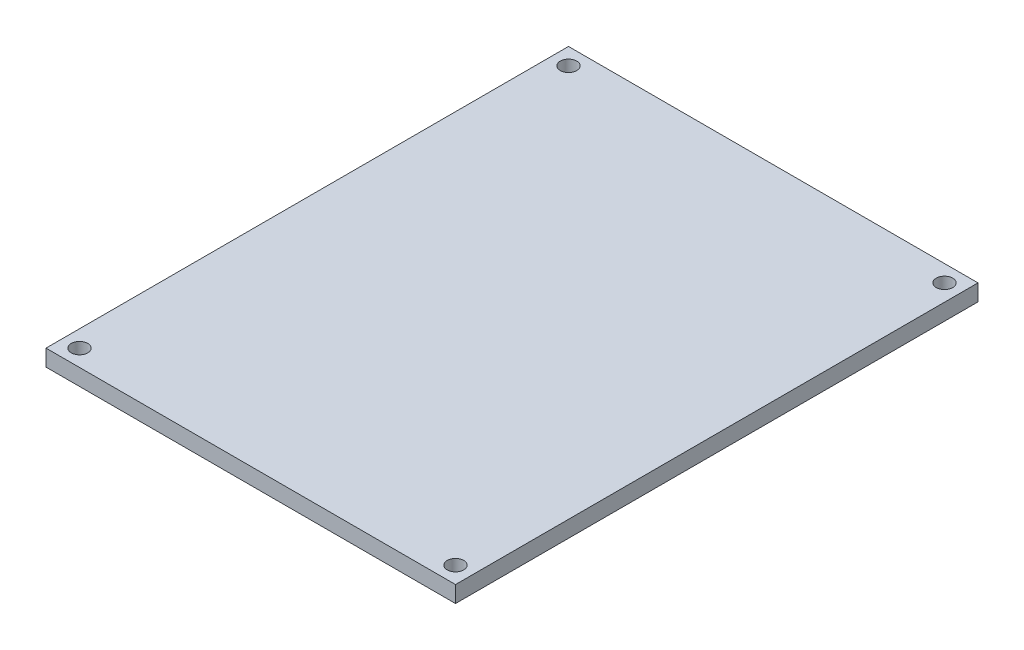
from build123d import *

# Parameters (mm, degrees)
SKETCH_1_W      = 74.56
SKETCH_1_H      = 95.13
SKETCH_1_R      = 1.5
EXTRUDE_1_DEPTH = 3


with BuildPart() as part:
    # 草图1 → 凸台-拉伸1 (new body)
    with BuildSketch(Plane(origin=(0, 0, 0), x_dir=(1, 0, 0), z_dir=(0, 1, 0))):
        Rectangle(SKETCH_1_W, SKETCH_1_H)
        with Locations(Location((-34.225, 44.515, 0), (0, 0, 270))):
            Circle(SKETCH_1_R, mode=Mode.SUBTRACT)
        with Locations(Location((34.225, 44.515, 0), (0, 0, 90))):
            Circle(SKETCH_1_R, mode=Mode.SUBTRACT)
        with Locations(Location((34.225, -44.515, 0), (0, 0, 270))):
            Circle(SKETCH_1_R, mode=Mode.SUBTRACT)
        with Locations(Location((-34.225, -44.515, 0), (0, 0, 90))):
            Circle(SKETCH_1_R, mode=Mode.SUBTRACT)
    extrude(amount=EXTRUDE_1_DEPTH)


solid = part.part
